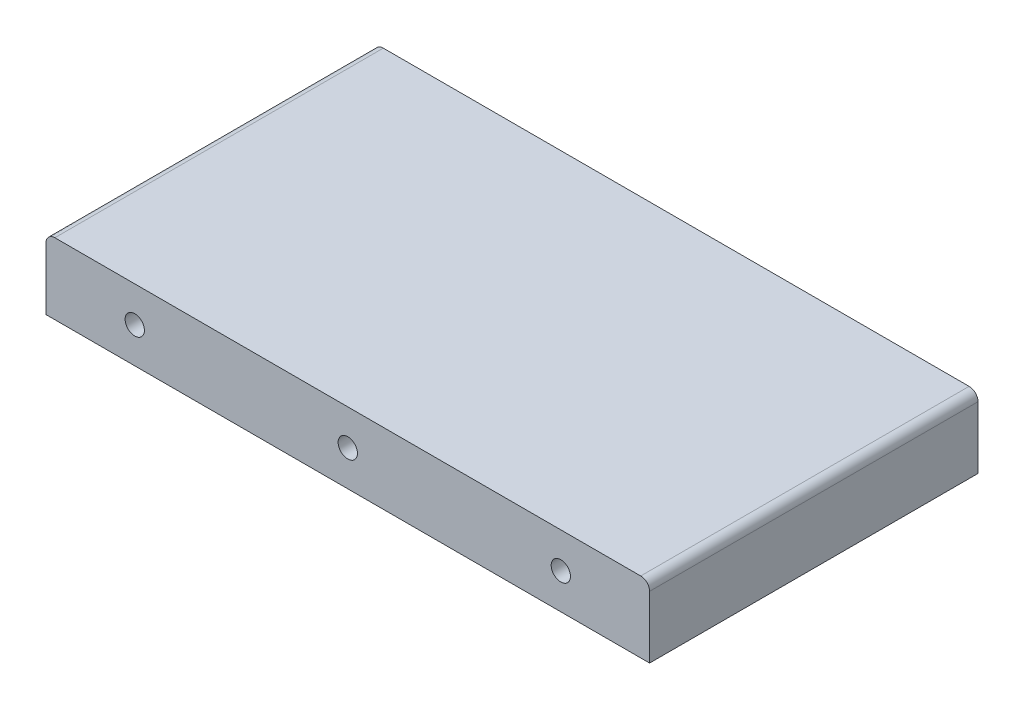
from build123d import *

# Parameters (mm, degrees)
SKETCH1_W                          = 107.95
SKETCH1_H                          = 12.7
BOSS_EXTRUDE1_DEPTH                = 29.36875
TAP_DRILL_FOR_8_32_TAP1_AT_2_COUNT = 2
TAP_DRILL_FOR_8_32_TAP1_AT_2_PITCH = 76.2
TAP_DRILL_FOR_8_32_TAP1_AT_3_COUNT = 2
TAP_DRILL_FOR_8_32_TAP1_AT_3_PITCH = 38.1
FILLET1_R                          = 1.5875


with BuildPart() as part:
    # Sketch1 → Boss-Extrude1 (new, symmetric)
    with BuildSketch(Plane.XY):
        Rectangle(SKETCH1_W, SKETCH1_H)
    extrude(amount=BOSS_EXTRUDE1_DEPTH, both=True)

    # Sketch4 → Tap Drill for #8-32 Tap1 (revolve, cut)
    with BuildSketch(Plane(origin=(-38.1, 0, 29.36875), x_dir=(0, -1, 0), z_dir=(1, 0, 0))):
        Polygon((0, 0), (0, 20.087806461), (1.7272, 19.05), (1.7272, 0), align=None)
    tap_drill_for_8_32_tap1 = revolve(axis=Axis((-38.1, 0, 35.71875), (0, 0, -1)), mode=Mode.SUBTRACT)

    # Tap Drill for #8-32 Tap1 at 2: Tap Drill for #8-32 Tap1 ×2
    with Locations(*[(i * TAP_DRILL_FOR_8_32_TAP1_AT_2_PITCH, 0, 0) for i in range(1, TAP_DRILL_FOR_8_32_TAP1_AT_2_COUNT)]):
        add(tap_drill_for_8_32_tap1, mode=Mode.SUBTRACT)

    # Tap Drill for #8-32 Tap1 at 3: Tap Drill for #8-32 Tap1 ×2
    with Locations(*[(i * TAP_DRILL_FOR_8_32_TAP1_AT_3_PITCH, 0, 0) for i in range(1, TAP_DRILL_FOR_8_32_TAP1_AT_3_COUNT)]):
        add(tap_drill_for_8_32_tap1, mode=Mode.SUBTRACT)

    # Mirror1: Tap Drill for #8-32 Tap1 across plane
    add(tap_drill_for_8_32_tap1.mirror(Plane.XY), mode=Mode.SUBTRACT)

    # Mirror1 copy 1 sketch → Mirror1 copy 1 (revolve, cut)
    with BuildSketch(Plane(origin=(38.1, 0, -29.36875), x_dir=(0, -1, 0), z_dir=(1, 0, 0))):
        Polygon((0, 0), (0, -20.087806461), (1.7272, -19.05), (1.7272, 0), align=None)
    revolve(axis=Axis((38.1, 0, -35.71875), (0, 0, -1)), mode=Mode.SUBTRACT)

    # Mirror1 copy 2 sketch → Mirror1 copy 2 (revolve, cut)
    with BuildSketch(Plane(origin=(0, 0, -29.36875), x_dir=(0, -1, 0), z_dir=(1, 0, 0))):
        Polygon((0, 0), (0, -20.087806461), (1.7272, -19.05), (1.7272, 0), align=None)
    revolve(axis=Axis((0, 0, -35.71875), (0, 0, -1)), mode=Mode.SUBTRACT)

    # Fillet1
    fillet1_edges = [part.edges().sort_by_distance(p)[0] for p in [
        (-53.975, 6.35, 0),
        (53.975, 6.35, 0),
    ]]
    fillet(fillet1_edges, radius=FILLET1_R)


solid = part.part
